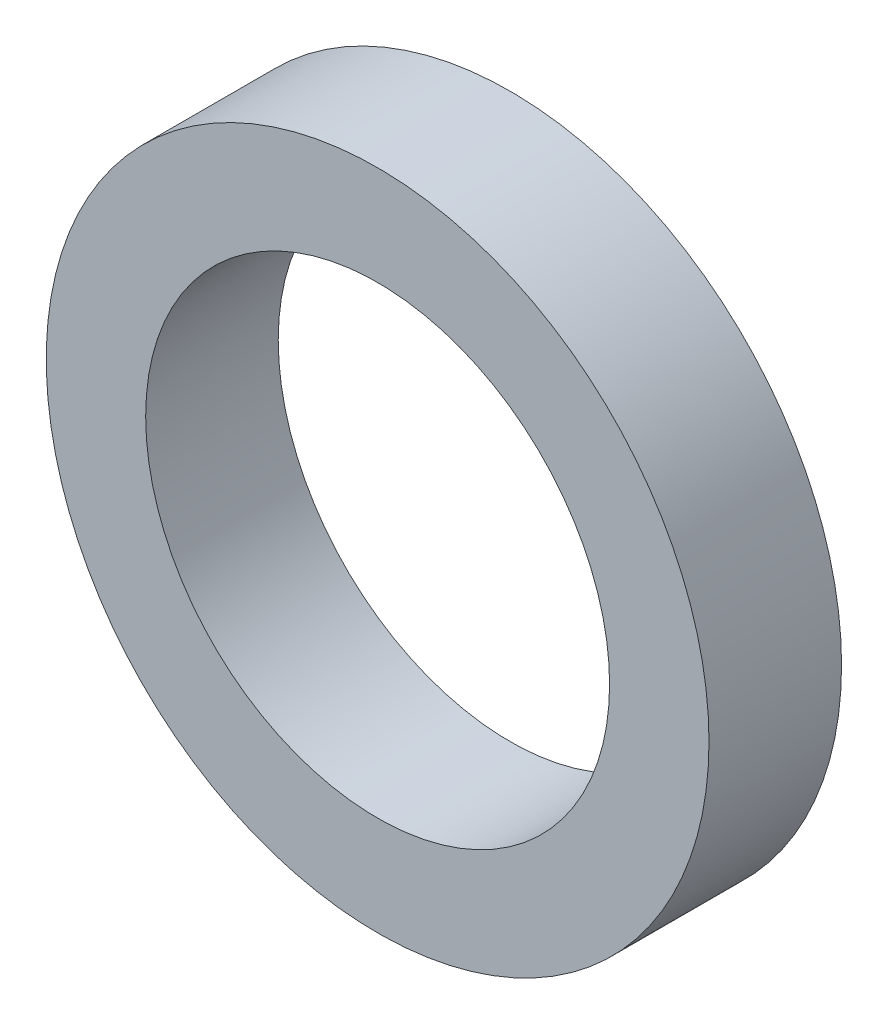
from build123d import *

# Parameters (mm, degrees)
SKETCH1_R           = 5
SKETCH1_R_2         = 3.5
BOSS_EXTRUDE1_DEPTH = 2


with BuildPart() as part:
    # Sketch1 → Boss-Extrude1 (new body)
    with BuildSketch(Plane.XY):
        Circle(SKETCH1_R)
        Circle(SKETCH1_R_2, mode=Mode.SUBTRACT)
    extrude(amount=BOSS_EXTRUDE1_DEPTH)


solid = part.part
